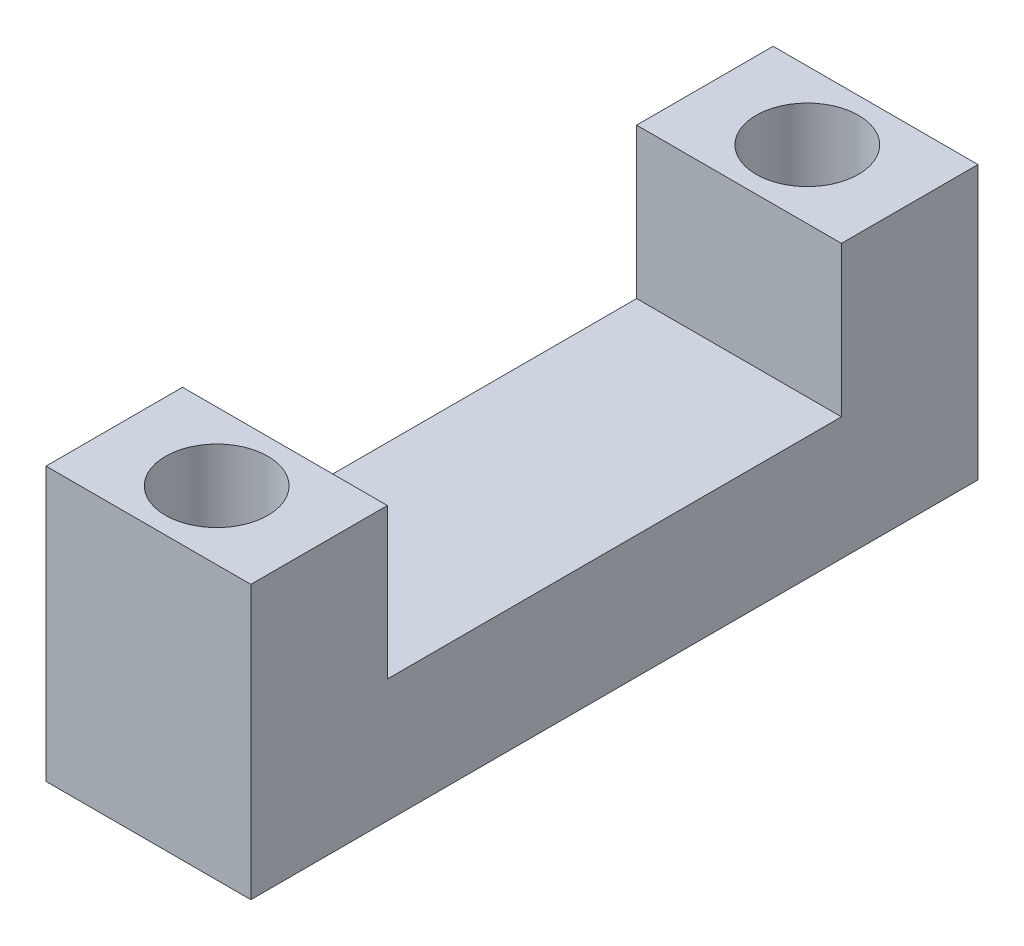
from build123d import *

# Parameters (mm, degrees)
EXTRUDE_1_DEPTH  = 6
MM_CLEARANCE_1_D = 3


with BuildPart() as part:
    # 草图1 → 凸台-拉伸1 (new body)
    with BuildSketch(Plane(origin=(0, 0, 0), x_dir=(0, 0, -1), z_dir=(1, 0, 0))):
        Polygon((0, 0), (0, 8), (4, 8), (4, 3.6), (17.3, 3.6), (17.3, 8), (21.3, 8), (21.3, 0), align=None)
    extrude(amount=EXTRUDE_1_DEPTH)

    # 大小mm Clearance 暗销孔1 (through all)
    with Locations(Plane(origin=(3, 8, -2), x_dir=(0, 0, 1), z_dir=(0, 1, 0))):
        with Locations((0, 0), (-17.3, 0)):
            Hole(MM_CLEARANCE_1_D / 2)


solid = part.part
